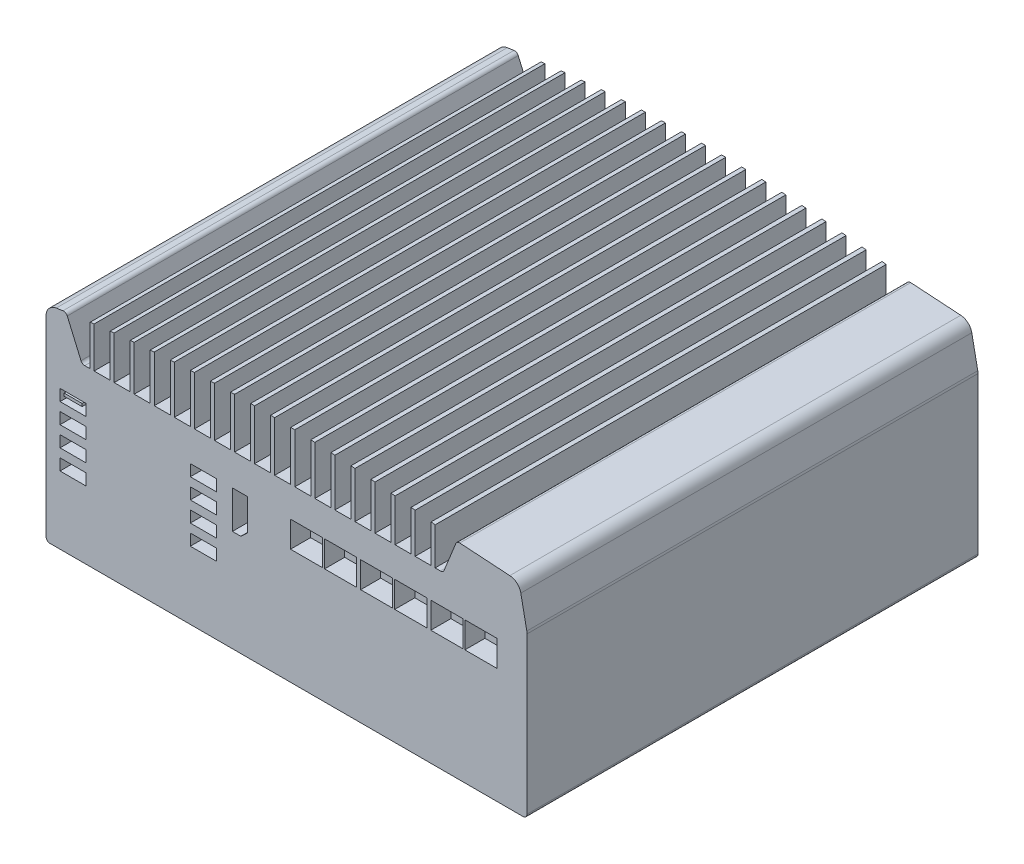
from build123d import *

# Parameters (mm, degrees)
ESQUISSE1_W             = 13
ESQUISSE1_H             = 5.7
ESQUISSE1_W_2           = 16
ESQUISSE1_H_2           = 13
BOSS_EXTRU_1_DEPTH      = 10
ESQUISSE1_W_3           = 9
ESQUISSE1_H_3           = 1.4
BOSS_EXTRU_1_2_DEPTH    = 10
CONG_1_R                = 6
CONG_2_R                = 2
BOSS_EXTRU_2_START      = 215
BOSS_EXTRU_2_DEPTH      = 215
ESQUISSE3_R             = 1.6
ESQUISSE3_W             = 24
ESQUISSE3_H             = 8
ENL_V_MAT_EXTRU_1_DEPTH = 10
ESQUISSE4_R             = 1.65
ENL_V_MAT_EXTRU_2_DEPTH = 10


with BuildPart() as part:
    # Esquisse1 → Boss.-Extru.1 (new body)
    with BuildSketch(Plane.XY):
        Polygon((0, 0), (0, 102.5), (10, 103.992224963), (18, 85.5), (22, 85.5), (22, 105.577138524), (24, 105.81957608), (24, 85.5), (32, 85.5), (32, 106.727539399), (34.003461675, 106.939476386), (34.003461675, 85.5), (42.003461675, 85.5), (42.003461675, 107.724257974), (44.00991635, 107.905684552), (44.00991635, 85.5), (52.00991635, 85.5), (52.00991635, 108.567798245), (54.018896892, 108.718705997), (54.018896892, 85.5), (62.018896892, 85.5), (62.018896892, 109.258583137), (64.029937459, 109.378965072), (64.029937459, 85.5), (72.029937459, 85.5), (72.029937459, 109.796955904), (74.042573255, 109.886806448), (74.042573255, 85.5), (82.042573255, 85.5), (82.042573255, 110.183181243), (84.056340297, 110.242496239), (84.056340297, 85.5), (92.056340297, 85.5), (92.056340297, 110.417446158), (94.070775173, 110.446222863), (94.070775173, 85.5), (102.070775173, 85.5), (102.070775173, 110.499860564), (104.085414808, 110.498097647), (104.085414808, 85.5), (112.085414808, 85.5), (112.085414808, 110.430457642), (114.099796232, 110.398155185), (114.099796232, 85.5), (122.099796232, 85.5), (122.099796232, 110.209193951), (124.113456342, 110.146353446), (124.113456342, 85.5), (132.113456342, 85.5), (132.113456342, 109.835949284), (134.125931673, 109.742573639), (134.125931673, 85.5), (142.125931673, 85.5), (142.125931673, 109.310526291), (144.136758159, 109.186619826), (144.136758159, 85.5), (152.136758159, 85.5), (152.136758159, 108.632649837), (154.145470898, 108.47821829), (154.145470898, 85.5), (162.145470898, 85.5), (162.145470898, 107.801966114), (164.151603909, 107.61701664), (164.151603909, 85.5), (172.151603909, 85.5), (172.151603909, 106.818041488), (174.154689895, 106.602582667), (174.154689895, 85.5), (182.154689895, 85.5), (182.154689895, 105.680361076), (184.154259986, 105.434402916), (184.154259986, 85.5), (192.154259986, 85.5), (192.154259986, 104.388327046), (194.149843496, 104.111880985), (194.149843496, 85.5), (198.149843496, 85.5), (205, 102.5), (236, 100.5), (240, 80.5), (240, 0), align=None)
        with Locations((78.5, 66.65)):
            Rectangle(ESQUISSE1_W, ESQUISSE1_H, mode=Mode.SUBTRACT)
        with Locations((130, 64)):
            Rectangle(ESQUISSE1_W_2, ESQUISSE1_H_2, mode=Mode.SUBTRACT)
        with Locations((147, 64)):
            Rectangle(ESQUISSE1_W_2, ESQUISSE1_H_2, mode=Mode.SUBTRACT)
        with Locations((165, 64)):
            Rectangle(ESQUISSE1_W_2, ESQUISSE1_H_2, mode=Mode.SUBTRACT)
        with Locations((182, 64)):
            Rectangle(ESQUISSE1_W_2, ESQUISSE1_H_2, mode=Mode.SUBTRACT)
        with Locations((200, 64)):
            Rectangle(ESQUISSE1_W_2, ESQUISSE1_H_2, mode=Mode.SUBTRACT)
        with Locations((217, 64)):
            Rectangle(ESQUISSE1_W_2, ESQUISSE1_H_2, mode=Mode.SUBTRACT)
        with Locations((78.5, 56.65)):
            Rectangle(ESQUISSE1_W, ESQUISSE1_H, mode=Mode.SUBTRACT)
        with Locations((78.5, 46.65)):
            Rectangle(ESQUISSE1_W, ESQUISSE1_H, mode=Mode.SUBTRACT)
        with Locations((78.5, 36.65)):
            Rectangle(ESQUISSE1_W, ESQUISSE1_H, mode=Mode.SUBTRACT)
        with Locations((13.5, 56.65)):
            Rectangle(ESQUISSE1_W, ESQUISSE1_H, mode=Mode.SUBTRACT)
        with Locations((13.5, 46.65)):
            Rectangle(ESQUISSE1_W, ESQUISSE1_H, mode=Mode.SUBTRACT)
        with Locations((13.5, 36.65)):
            Rectangle(ESQUISSE1_W, ESQUISSE1_H, mode=Mode.SUBTRACT)
        Polygon((93, 69.5), (93, 50.7), (97.2, 50.7), (100.6, 53.8), (100.6, 69.5), align=None, mode=Mode.SUBTRACT)
        with Locations((13.5, 66.65)):
            Rectangle(ESQUISSE1_W, ESQUISSE1_H, mode=Mode.SUBTRACT)
    extrude(amount=-BOSS_EXTRU_1_DEPTH)

    # Congé1
    cong_1_edges = [part.edges().sort_by_distance(p)[0] for p in [
        (0, 102.5, -5),
        (236, 100.5, -5),
        (240, 80.5, -5),
    ]]
    fillet(cong_1_edges, radius=CONG_1_R)

    # Congé2
    cong_2_edges = [part.edges().sort_by_distance(p)[0] for p in [
        (0, 0, -5),
        (10, 103.992224963, -5),
        (18, 85.5, -5),
        (198.149843496, 85.5, -5),
        (205, 102.5, -5),
        (240, 0, -5),
    ]]
    fillet(cong_2_edges, radius=CONG_2_R)

    # Esquisse2 → Boss.-Extru.2 (add)
    with BuildSketch(Plane(origin=(0, 0, -10), x_dir=(-1, 0, 0), z_dir=(0, 0, -1)).offset(BOSS_EXTRU_2_START)):
        with BuildLine():
            Line((-198.654539988, 86.752502823), (-204.459454856, 101.158531752))
            ThreePointArc((-204.459454856, 101.158531752), (-205.249329218, 102.103777717), (-206.443279511, 102.406885193))
            Line((-206.443279511, 102.406885193), (-231.405699323, 100.796406495))
            ThreePointArc((-231.405699323, 100.796406495), (-234.9708117, 99.323983684), (-236.90288971, 95.985551452))
            Line((-236.90288971, 95.985551452), (-239.883484054, 81.082579729))
            ThreePointArc((-239.883484054, 81.082579729), (-239.97079996, 80.497108626), (-240, 79.905882918))
            Line((-240, 79.905882918), (-240, 2))
            ThreePointArc((-240, 2), (-239.414213562, 0.585786438), (-238, 0))
            Line((-238, 0), (-2, 0))
            ThreePointArc((-2, 0), (-0.585786438, 0.585786438), (0, 2))
            Line((0, 2), (0, 97.32890071))
            ThreePointArc((0, 97.32890071), (-1.455047837, 101.245967194), (-5.114469946, 103.263193972))
            Line((-5.114469946, 103.263193972), (-8.479594606, 103.765346274))
            ThreePointArc((-8.479594606, 103.765346274), (-9.746203645, 103.53548168), (-10.610363757, 102.581351975))
            Line((-10.610363757, 102.581351975), (-17.478311973, 86.705896545))
            ThreePointArc((-17.478311973, 86.705896545), (-18.21577123, 85.828442805), (-19.313904439, 85.5))
            Line((-19.313904439, 85.5), (-22, 85.5))
            Line((-22, 85.5), (-22, 105.577138524))
            Line((-22, 105.577138524), (-24, 105.81957608))
            Line((-24, 105.81957608), (-24, 85.5))
            Line((-24, 85.5), (-32, 85.5))
            Line((-32, 85.5), (-32, 106.727539399))
            Line((-32, 106.727539399), (-34.003461675, 106.939476386))
            Line((-34.003461675, 106.939476386), (-34.003461675, 85.5))
            Line((-34.003461675, 85.5), (-42.003461675, 85.5))
            Line((-42.003461675, 85.5), (-42.003461675, 107.724257974))
            Line((-42.003461675, 107.724257974), (-44.00991635, 107.905684552))
            Line((-44.00991635, 107.905684552), (-44.00991635, 85.5))
            Line((-44.00991635, 85.5), (-52.00991635, 85.5))
            Line((-52.00991635, 85.5), (-52.00991635, 108.567798245))
            Line((-52.00991635, 108.567798245), (-54.018896892, 108.718705997))
            Line((-54.018896892, 108.718705997), (-54.018896892, 85.5))
            Line((-54.018896892, 85.5), (-62.018896892, 85.5))
            Line((-62.018896892, 85.5), (-62.018896892, 109.258583137))
            Line((-62.018896892, 109.258583137), (-64.029937459, 109.378965072))
            Line((-64.029937459, 109.378965072), (-64.029937459, 85.5))
            Line((-64.029937459, 85.5), (-72.029937459, 85.5))
            Line((-72.029937459, 85.5), (-72.029937459, 109.796955904))
            Line((-72.029937459, 109.796955904), (-74.042573255, 109.886806448))
            Line((-74.042573255, 109.886806448), (-74.042573255, 85.5))
            Line((-74.042573255, 85.5), (-82.042573255, 85.5))
            Line((-82.042573255, 85.5), (-82.042573255, 110.183181243))
            Line((-82.042573255, 110.183181243), (-84.056340297, 110.242496239))
            Line((-84.056340297, 110.242496239), (-84.056340297, 85.5))
            Line((-84.056340297, 85.5), (-92.056340297, 85.5))
            Line((-92.056340297, 85.5), (-92.056340297, 110.417446158))
            Line((-92.056340297, 110.417446158), (-94.070775173, 110.446222863))
            Line((-94.070775173, 110.446222863), (-94.070775173, 85.5))
            Line((-94.070775173, 85.5), (-102.070775173, 85.5))
            Line((-102.070775173, 85.5), (-102.070775173, 110.499860564))
            Line((-102.070775173, 110.499860564), (-104.085414808, 110.498097647))
            Line((-104.085414808, 110.498097647), (-104.085414808, 85.5))
            Line((-104.085414808, 85.5), (-112.085414808, 85.5))
            Line((-112.085414808, 85.5), (-112.085414808, 110.430457642))
            Line((-112.085414808, 110.430457642), (-114.099796232, 110.398155185))
            Line((-114.099796232, 110.398155185), (-114.099796232, 85.5))
            Line((-114.099796232, 85.5), (-122.099796232, 85.5))
            Line((-122.099796232, 85.5), (-122.099796232, 110.209193951))
            Line((-122.099796232, 110.209193951), (-124.113456342, 110.146353446))
            Line((-124.113456342, 110.146353446), (-124.113456342, 85.5))
            Line((-124.113456342, 85.5), (-132.113456342, 85.5))
            Line((-132.113456342, 85.5), (-132.113456342, 109.835949284))
            Line((-132.113456342, 109.835949284), (-134.125931673, 109.742573639))
            Line((-134.125931673, 109.742573639), (-134.125931673, 85.5))
            Line((-134.125931673, 85.5), (-142.125931673, 85.5))
            Line((-142.125931673, 85.5), (-142.125931673, 109.310526291))
            Line((-142.125931673, 109.310526291), (-144.136758159, 109.186619826))
            Line((-144.136758159, 109.186619826), (-144.136758159, 85.5))
            Line((-144.136758159, 85.5), (-152.136758159, 85.5))
            Line((-152.136758159, 85.5), (-152.136758159, 108.632649837))
            Line((-152.136758159, 108.632649837), (-154.145470898, 108.47821829))
            Line((-154.145470898, 108.47821829), (-154.145470898, 85.5))
            Line((-154.145470898, 85.5), (-162.145470898, 85.5))
            Line((-162.145470898, 85.5), (-162.145470898, 107.801966114))
            Line((-162.145470898, 107.801966114), (-164.151603909, 107.61701664))
            Line((-164.151603909, 107.61701664), (-164.151603909, 85.5))
            Line((-164.151603909, 85.5), (-172.151603909, 85.5))
            Line((-172.151603909, 85.5), (-172.151603909, 106.818041488))
            Line((-172.151603909, 106.818041488), (-174.154689895, 106.602582667))
            Line((-174.154689895, 106.602582667), (-174.154689895, 85.5))
            Line((-174.154689895, 85.5), (-182.154689895, 85.5))
            Line((-182.154689895, 85.5), (-182.154689895, 105.680361076))
            Line((-182.154689895, 105.680361076), (-184.154259986, 105.434402916))
            Line((-184.154259986, 105.434402916), (-184.154259986, 85.5))
            Line((-184.154259986, 85.5), (-192.154259986, 85.5))
            Line((-192.154259986, 85.5), (-192.154259986, 104.388327046))
            Line((-192.154259986, 104.388327046), (-194.149843496, 104.111880985))
            Line((-194.149843496, 104.111880985), (-194.149843496, 85.5))
            Line((-194.149843496, 85.5), (-196.799479889, 85.5))
            ThreePointArc((-196.799479889, 85.5), (-197.918632614, 85.842442406), (-198.654539988, 86.752502823))
        make_face()
    extrude(amount=-BOSS_EXTRU_2_DEPTH)

    # Esquisse3 → Enlèv. mat.-Extru.1 (cut)
    with BuildSketch(Plane(origin=(0, 0, -225), x_dir=(-1, 0, 0), z_dir=(0, 0, -1))):
        with Locations((-37, 65.5)):
            Circle(ESQUISSE3_R)
        with Locations(Location((-62, 65.5, 0), (0, 0, 180))):
            Circle(ESQUISSE3_R)
        with Locations((-117, 65.5)):
            Circle(ESQUISSE3_R)
        with Locations(Location((-142, 65.5, 0), (0, 0, 180))):
            Circle(ESQUISSE3_R)
        with Locations((-77, 65.5)):
            Circle(ESQUISSE3_R)
        with Locations(Location((-102, 65.5, 0), (0, 0, 180))):
            Circle(ESQUISSE3_R)
        with Locations((-37, 45.5)):
            Circle(ESQUISSE3_R)
        with Locations(Location((-62, 45.5, 0), (0, 0, 180))):
            Circle(ESQUISSE3_R)
        with Locations((-17, 47.5)):
            Rectangle(ESQUISSE3_W, ESQUISSE3_H)
        with Locations((-17, 67.5)):
            Rectangle(ESQUISSE3_W, ESQUISSE3_H)
        with BuildLine():
            Line((-58.180099256, 68.699007438), (-58.780099256, 62.699007438))
            ThreePointArc((-58.780099256, 62.699007438), (-58.272929943, 61.157989358), (-56.790024876, 60.5))
            Line((-56.790024876, 60.5), (-42.209975124, 60.5))
            ThreePointArc((-42.209975124, 60.5), (-40.727070057, 61.157989358), (-40.219900744, 62.699007438))
            Line((-40.219900744, 62.699007438), (-40.819900744, 68.699007438))
            ThreePointArc((-40.819900744, 68.699007438), (-41.467964483, 69.982905067), (-42.809975124, 70.5))
            Line((-42.809975124, 70.5), (-56.190024876, 70.5))
            ThreePointArc((-56.190024876, 70.5), (-57.532035517, 69.982905067), (-58.180099256, 68.699007438))
        make_face()
        with BuildLine():
            Line((-138.180099256, 68.699007438), (-138.780099256, 62.699007438))
            ThreePointArc((-138.780099256, 62.699007438), (-138.272929943, 61.157989358), (-136.790024876, 60.5))
            Line((-136.790024876, 60.5), (-122.209975124, 60.5))
            ThreePointArc((-122.209975124, 60.5), (-120.727070057, 61.157989358), (-120.219900744, 62.699007438))
            Line((-120.219900744, 62.699007438), (-120.819900744, 68.699007438))
            ThreePointArc((-120.819900744, 68.699007438), (-121.467964483, 69.982905067), (-122.809975124, 70.5))
            Line((-122.809975124, 70.5), (-136.190024876, 70.5))
            ThreePointArc((-136.190024876, 70.5), (-137.532035517, 69.982905067), (-138.180099256, 68.699007438))
        make_face()
        with BuildLine():
            Line((-98.180099256, 68.699007438), (-98.780099256, 62.699007438))
            ThreePointArc((-98.780099256, 62.699007438), (-98.272929943, 61.157989358), (-96.790024876, 60.5))
            Line((-96.790024876, 60.5), (-82.209975124, 60.5))
            ThreePointArc((-82.209975124, 60.5), (-80.727070057, 61.157989358), (-80.219900744, 62.699007438))
            Line((-80.219900744, 62.699007438), (-80.819900744, 68.699007438))
            ThreePointArc((-80.819900744, 68.699007438), (-81.467964483, 69.982905067), (-82.809975124, 70.5))
            Line((-82.809975124, 70.5), (-96.190024876, 70.5))
            ThreePointArc((-96.190024876, 70.5), (-97.532035517, 69.982905067), (-98.180099256, 68.699007438))
        make_face()
        with BuildLine():
            Line((-58.180099256, 48.699007438), (-58.780099256, 42.699007438))
            ThreePointArc((-58.780099256, 42.699007438), (-58.272929943, 41.157989358), (-56.790024876, 40.5))
            Line((-56.790024876, 40.5), (-42.209975124, 40.5))
            ThreePointArc((-42.209975124, 40.5), (-40.727070057, 41.157989358), (-40.219900744, 42.699007438))
            Line((-40.219900744, 42.699007438), (-40.819900744, 48.699007438))
            ThreePointArc((-40.819900744, 48.699007438), (-41.467964483, 49.982905067), (-42.809975124, 50.5))
            Line((-42.809975124, 50.5), (-56.190024876, 50.5))
            ThreePointArc((-56.190024876, 50.5), (-57.532035517, 49.982905067), (-58.180099256, 48.699007438))
        make_face()
    extrude(amount=-ENL_V_MAT_EXTRU_1_DEPTH, mode=Mode.SUBTRACT)

    # Esquisse4 → Enlèv. mat.-Extru.2 (cut)
    with BuildSketch(Plane.XZ):
        with Locations((228, -200)):
            Circle(ESQUISSE4_R)
        with Locations((228, -25)):
            Circle(ESQUISSE4_R)
        with Locations((12, -200)):
            Circle(ESQUISSE4_R)
        with Locations((12, -25)):
            Circle(ESQUISSE4_R)
    extrude(amount=-ENL_V_MAT_EXTRU_2_DEPTH, mode=Mode.SUBTRACT)


with BuildPart() as body_2:
    # Esquisse1 → Boss.-Extru.1 2 (new body)
    with BuildSketch(Plane.XY):
        with Locations((13.5, 67.8)):
            Rectangle(ESQUISSE1_W_3, ESQUISSE1_H_3)
    extrude(amount=-BOSS_EXTRU_1_2_DEPTH)


solid = Compound([part.part, body_2.part])
